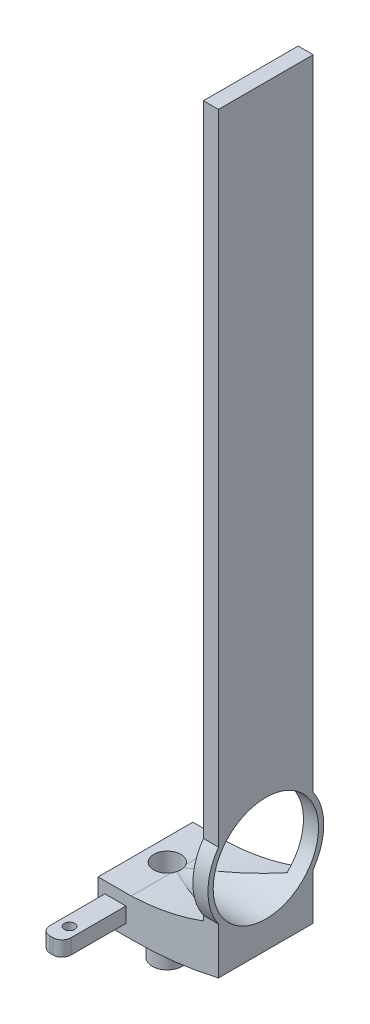
from build123d import *
from build123d.topology import SkipClean

# Parameters (mm, degrees)
BOSS_EXTRUDE1_DEPTH       = 48
SKETCH2_W                 = 14
SKETCH2_H                 = 10
BOSS_EXTRUDE2_DEPTH       = 50
CUT_EXTRUDE1_DEPTH        = 98
M8X1_0_TAPPED_HOLE1_D     = 7
M8X1_0_TAPPED_HOLE1_DEPTH = 10
M8X1_0_TAPPED_HOLE1_TIP   = 2.103012167
FILLET1_R                 = 6
SKETCH7_R                 = 38.5
SKETCH7_R_2               = 35
BOSS_EXTRUDE3_DEPTH       = 10
SKETCH8_R                 = 35
CUT_EXTRUDE2_DEPTH        = 90
BOSS_EXTRUDE4_DEPTH       = 5
BOSS_EXTRUDE4_DEPTH_BACK  = 10
SKETCH10_R                = 12
SKETCH10_R_2              = 9
BOSS_EXTRUDE5_START       = 25
SKETCH11_R                = 10
SKETCH11_R_2              = 9
BOSS_EXTRUDE5_DEPTH       = 25
SKETCH12_R                = 9
CUT_EXTRUDE3_DEPTH        = 42
BOSS_EXTRUDE6_DEPTH       = 7.5
BOSS_EXTRUDE7_START       = 7.5
BOSS_EXTRUDE7_DEPTH       = 7.5
BOSS_EXTRUDE8_DEPTH       = 10


with BuildPart() as part:
    # Sketch1 → Boss-Extrude1 (new body)
    with BuildSketch(Plane.XY):
        with BuildLine():
            Line((0, 0), (0, 25.00039893))
            Line((0, 25.00039893), (22, 25.00039893))
            ThreePointArc((22, 25.00039893), (51.667114877, 29.062120939), (80, 38.751440389))
            Line((80, 38.751440389), (80, 6.798665084))
            ThreePointArc((80, 6.798665084), (51.198552391, 1.705464917), (22, 0))
            Line((22, 0), (0, 0))
        make_face()
    extrude(amount=BOSS_EXTRUDE1_DEPTH)

    # Sketch2 → Boss-Extrude2 (add)
    with BuildSketch(Plane.XY.offset(48)):
        with Locations((11.5, 12.5)):
            Rectangle(SKETCH2_W, SKETCH2_H)
    boss_extrude2 = extrude(amount=BOSS_EXTRUDE2_DEPTH)

    # Mirror1: Boss-Extrude2 across plane
    add(boss_extrude2.mirror(Plane.XY.offset(24)))

    # Sketch3 → Cut-Extrude1 (cut)
    with BuildSketch(Plane(origin=(0, 0, 0), x_dir=(1, 0, 0), z_dir=(0, 1, 0))):
        Polygon((32.759036304, 13.5), (11.5, 13.5), (-23.123003772, 13.5), (-23.123003772, 84.867154232), (32.759036304, 84.867154232), align=None)
    extrude(amount=CUT_EXTRUDE1_DEPTH, mode=Mode.SUBTRACT)

    # M8x1.0 Tapped Hole1
    with Locations(Plane(origin=(11.5, 17.5, 86), x_dir=(0, 0, 1), z_dir=(0, 1, 0))):
        with Locations((0, 0)):
            Hole(M8X1_0_TAPPED_HOLE1_D / 2, depth=M8X1_0_TAPPED_HOLE1_DEPTH)
            with Locations((0, 0, -(M8X1_0_TAPPED_HOLE1_DEPTH + M8X1_0_TAPPED_HOLE1_TIP / 2))):  # 118° drill point
                Cone(0, M8X1_0_TAPPED_HOLE1_D / 2, M8X1_0_TAPPED_HOLE1_TIP, mode=Mode.SUBTRACT)

    # Fillet1
    fillet1_edges = [part.edges().sort_by_distance(p)[0] for p in [
        (18.5, 12.5, 98),
        (4.5, 12.5, 98),
    ]]
    fillet(fillet1_edges, radius=FILLET1_R)

    # Sketch7 → Boss-Extrude3 (add)
    with BuildSketch(Plane.ZY.offset(-80)):
        with Locations((24, 60.00039893)):
            Circle(SKETCH7_R)
        with Locations((24, 60.00039893)):
            Circle(SKETCH7_R_2, mode=Mode.SUBTRACT)
    extrude(amount=BOSS_EXTRUDE3_DEPTH)

    # Sketch8 → Cut-Extrude2 (cut)
    with BuildSketch(Plane.ZY.offset(-80)):
        with Locations(Location((24, 60.00039893, 0), (0, 0, 226.708192407))):
            Circle(SKETCH8_R)
    extrude(amount=CUT_EXTRUDE2_DEPTH, mode=Mode.SUBTRACT)

    # Sketch10 → Boss-Extrude4 (add, two sides: drawn at the far end of the back side and taken through both)
    with BuildSketch(Plane.XZ.offset(-BOSS_EXTRUDE4_DEPTH_BACK)):
        with Locations((14.5, 24)):
            Circle(SKETCH10_R)
        with Locations((14.5, 24)):
            Circle(SKETCH10_R_2, mode=Mode.SUBTRACT)
    extrude(amount=BOSS_EXTRUDE4_DEPTH + BOSS_EXTRUDE4_DEPTH_BACK)

    # Sketch11 → Boss-Extrude5 (add)
    with BuildSketch(Plane.XZ.offset(5).offset(BOSS_EXTRUDE5_START)):
        with Locations((14.5, 24)):
            Circle(SKETCH11_R)
        with Locations((14.5, 24)):
            Circle(SKETCH11_R_2, mode=Mode.SUBTRACT)
    extrude(amount=-BOSS_EXTRUDE5_DEPTH)

    # Sketch12 → Cut-Extrude3 (cut)
    with BuildSketch(Plane(origin=(0, 0, 0), x_dir=(-1, 0, 0), z_dir=(0, -1, 0))):
        with Locations(Location((-14.5, -24, 0), (0, 0, 180))):
            Circle(SKETCH12_R)
    extrude(amount=-CUT_EXTRUDE3_DEPTH, mode=Mode.SUBTRACT)

    # Sketch13 → Boss-Extrude6 (add)
    with BuildSketch(Plane.XY.offset(48)):
        with BuildLine():
            Line((0, 25.00039893), (0, 0))
            Line((0, 0), (22, 0))
            ThreePointArc((22, 0), (51.198552391, 1.705464917), (80, 6.798665084))
            Line((80, 6.798665084), (80, 29.896412483))
            Line((80, 29.896412483), (80, 34.524920524))
            Line((80, 34.524920524), (70, 34.524920524))
            Line((70, 34.524920524), (69.729925021, 34.524920524))
            ThreePointArc((69.729925021, 34.524920524), (46.24106465, 27.877911315), (22, 25.00039893))
            Line((22, 25.00039893), (0, 25.00039893))
        make_face()
    extrude(amount=BOSS_EXTRUDE6_DEPTH)

    # Sketch14 → Boss-Extrude7 (add)
    with BuildSketch(Plane(origin=(0, 0, 0), x_dir=(-1, 0, 0), z_dir=(0, 0, -1)).offset(BOSS_EXTRUDE7_START)):
        with BuildLine():
            Line((-80, 29.896412483), (-80, 6.798665084))
            ThreePointArc((-80, 6.798665084), (-51.198552391, 1.705464917), (-22, 0))
            Line((-22, 0), (0, 0))
            Line((0, 0), (0, 25.00039893))
            Line((0, 25.00039893), (-22, 25.00039893))
            ThreePointArc((-22, 25.00039893), (-46.24106465, 27.877911315), (-69.729925021, 34.524920524))
            Line((-69.729925021, 34.524920524), (-70, 34.524920524))
            Line((-70, 34.524920524), (-80, 34.524920524))
            Line((-80, 34.524920524), (-80, 29.896412483))
        make_face()
    extrude(amount=-BOSS_EXTRUDE7_DEPTH)

    # Sketch15 → Boss-Extrude8 (add)
    with SkipClean():  # the faces are left unmerged after this step: merging them gives an invalid solid
        with BuildSketch(Plane(origin=(80, 0, 0), x_dir=(0, 0, -1), z_dir=(1, 0, 0))):
            with BuildLine():
                Line((-55.5, 6.798665084), (-55.5, 44.744252628))
                ThreePointArc((-55.5, 44.744252628), (-24, 25.00039893), (7.5, 44.744252628))
                Line((7.5, 44.744252628), (7.5, 6.798665084))
                Line((7.5, 6.798665084), (-55.5, 6.798665084))
            make_face()
            with BuildLine():
                Line((-55.5, 506.798665084), (7.5, 506.798665084))
                Line((7.5, 506.798665084), (7.5, 75.256545232))
                ThreePointArc((7.5, 75.256545232), (-24, 95.00039893), (-55.5, 75.256545232))
                Line((-55.5, 75.256545232), (-55.5, 506.798665084))
            make_face()
        extrude(amount=-BOSS_EXTRUDE8_DEPTH)


solid = part.part
